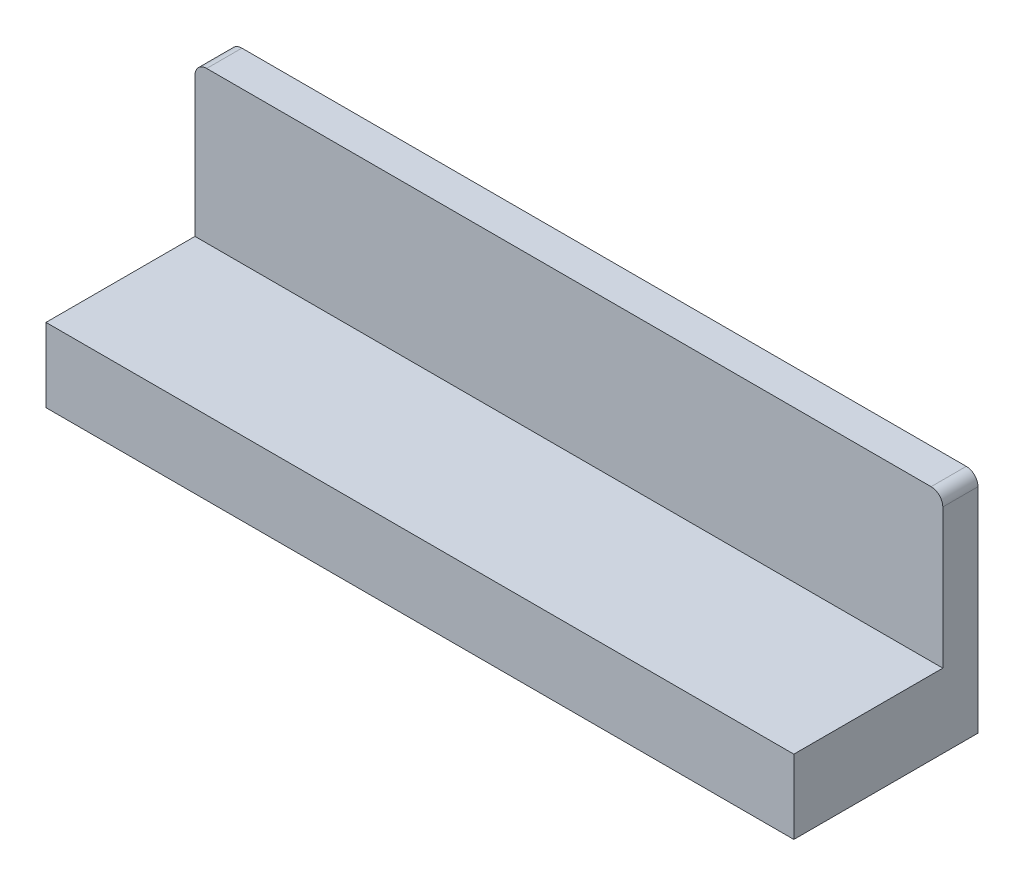
from build123d import *

# Parameters (mm, degrees)
BOSS_EXTRUDE1_DEPTH = 31.88
FILLET1_R           = 0.5
SHELL1_T            = -1.5
SKETCH2_R           = 1.5
SKETCH2_R_2         = 0.6
BOSS_EXTRUDE2_DEPTH = 1.45


with BuildPart() as part:
    # Sketch1 → Boss-Extrude1 (new body)
    with BuildSketch(Plane(origin=(0, 0, 0), x_dir=(0, 0, -1), z_dir=(1, 0, 0))):
        Polygon((0, 0), (-7.85, 0), (-7.85, 3.15), (-1.5, 3.15), (-1.5, 9.6), (0, 9.6), align=None)
    extrude(amount=-BOSS_EXTRUDE1_DEPTH)

    # Fillet1
    fillet1_edges = [part.edges().sort_by_distance(p)[0] for p in [
        (0, 9.6, 0.75),
        (-31.88, 9.6, 0.75),
    ]]
    fillet(fillet1_edges, radius=FILLET1_R)

    # Shell1
    shell1_openings = [part.faces().sort_by_distance(p)[0] for p in [
        (-15.94, 0, 3.925),
    ]]
    offset(amount=SHELL1_T, openings=shell1_openings, kind=Kind.INTERSECTION)

    # Sketch2 → Boss-Extrude2 (add)
    # profile 1 of 3: a face of its own
    with BuildSketch(Plane.XZ.offset(-1.65)):
        with Locations(Location((-23.91, 3.925, 0), (0, 0, 90))):
            Circle(SKETCH2_R)
        with Locations(Location((-23.91, 3.925, 0), (0, 0, 270))):
            Circle(SKETCH2_R_2, mode=Mode.SUBTRACT)
    # profile 2 of 3: a face of its own
    with BuildSketch(Plane.XZ.offset(-1.65)):
        with Locations(Location((-15.94, 3.925, 0), (0, 0, 90))):
            Circle(SKETCH2_R)
        with Locations(Location((-15.94, 3.925, 0), (0, 0, 270))):
            Circle(SKETCH2_R_2, mode=Mode.SUBTRACT)
    # profile 3 of 3: a face of its own
    with BuildSketch(Plane.XZ.offset(-1.65)):
        with Locations(Location((-7.97, 3.925, 0), (0, 0, 90))):
            Circle(SKETCH2_R)
        with Locations(Location((-7.97, 3.925, 0), (0, 0, 270))):
            Circle(SKETCH2_R_2, mode=Mode.SUBTRACT)
    extrude(amount=BOSS_EXTRUDE2_DEPTH)


solid = part.part
